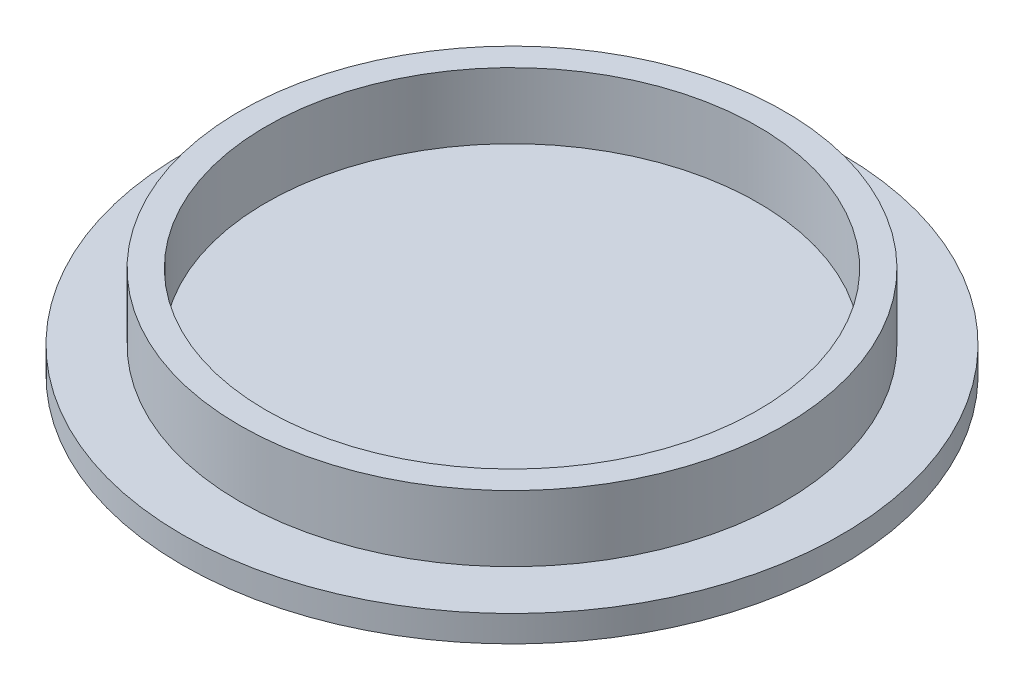
from build123d import *

# Parameters (mm, degrees)
SKETCH1_R           = 63.5
BOSS_EXTRUDE1_DEPTH = 5.08
SKETCH2_R           = 52.451
SKETCH2_R_2         = 47.371
BOSS_EXTRUDE2_DEPTH = 12.7


with BuildPart() as part:
    # Sketch1 → Boss-Extrude1 (new body)
    with BuildSketch(Plane(origin=(0, 0, 0), x_dir=(1, 0, 0), z_dir=(0, 1, 0))):
        with Locations(Location((0, 0, 0), (0, 0, 270))):
            Circle(SKETCH1_R)
    extrude(amount=BOSS_EXTRUDE1_DEPTH)

    # Sketch2 → Boss-Extrude2 (add)
    with BuildSketch(Plane(origin=(0, 5.08, 0), x_dir=(1, 0, 0), z_dir=(0, 1, 0))):
        with Locations(Location((0, 0, 0), (0, 0, 270))):
            Circle(SKETCH2_R)
        with Locations(Location((0, 0, 0), (0, 0, 270))):
            Circle(SKETCH2_R_2, mode=Mode.SUBTRACT)
    extrude(amount=BOSS_EXTRUDE2_DEPTH)


solid = part.part
